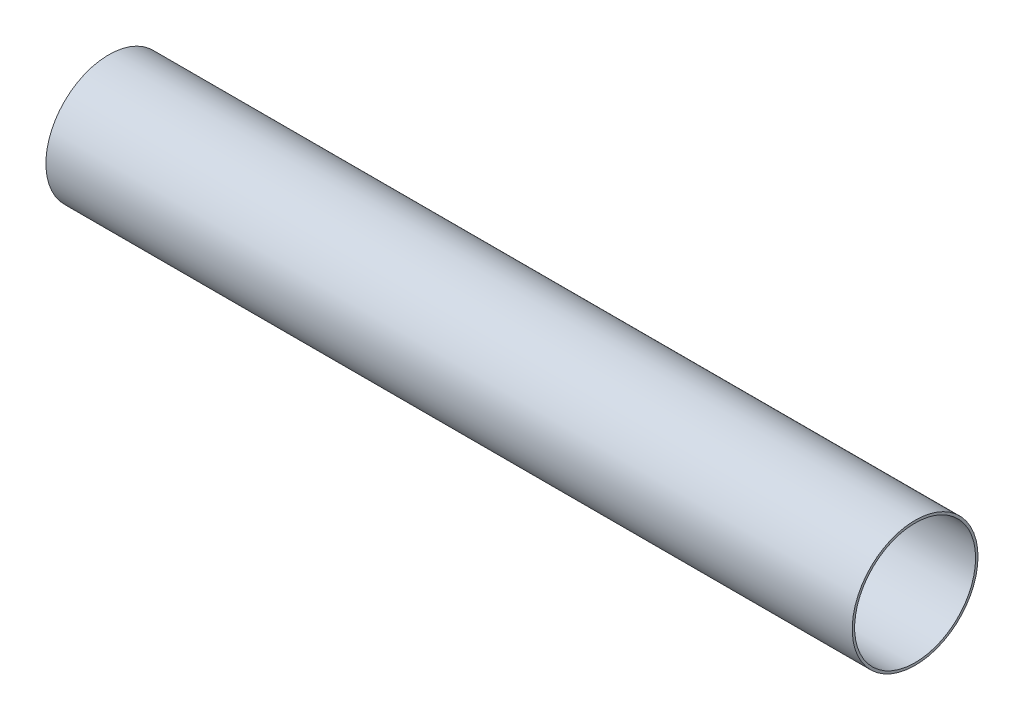
from build123d import *

# Parameters (mm, degrees)
SKETCH1_R           = 39.624
SKETCH1_R_2         = 38.1
BOSS_EXTRUDE1_DEPTH = 508


with BuildPart() as part:
    # Sketch1 → Boss-Extrude1 (new body)
    with BuildSketch(Plane.YZ):
        with Locations(Location((0, 0, 0), (0, 0, 270))):
            Circle(SKETCH1_R)
        with Locations(Location((0, 0, 0), (0, 0, 270))):
            Circle(SKETCH1_R_2, mode=Mode.SUBTRACT)
    extrude(amount=BOSS_EXTRUDE1_DEPTH)


solid = part.part
